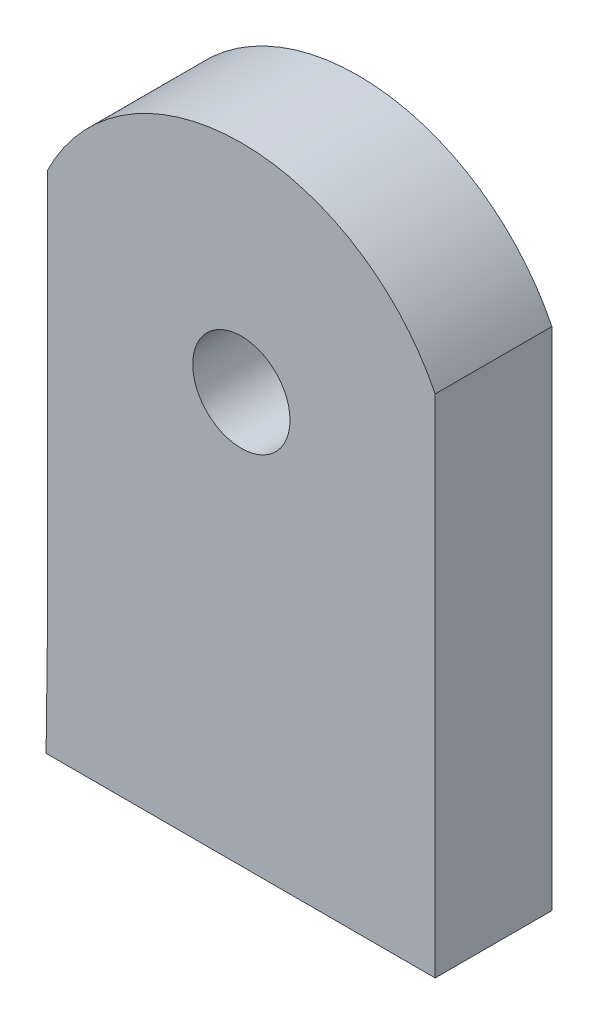
from build123d import *

# Parameters (mm, degrees)
SKETCH1_R           = 1.25
BOSS_EXTRUDE1_DEPTH = 3


with BuildPart() as part:
    # Sketch1 → Boss-Extrude1 (new body)
    with BuildSketch(Plane.XY):
        with BuildLine():
            Line((-10.453152026, 49.121338482), (-10.49069983, 46.121502107))
            Line((-10.49069983, 46.121502107), (-0.49069983, 46.121502107))
            Line((-0.49069983, 46.121502107), (-0.49069983, 49.121502107))
            Line((-0.49069983, 49.121502107), (-0.49069983, 59.121338482))
            ThreePointArc((-0.49069983, 59.121338482), (-5.471925928, 62.221036999), (-10.453152026, 59.121338482))
            Line((-10.453152026, 59.121338482), (-10.453152026, 49.121338482))
        make_face()
        with Locations((-5.471925928, 56.668764069)):
            Circle(SKETCH1_R, mode=Mode.SUBTRACT)
    extrude(amount=BOSS_EXTRUDE1_DEPTH)


solid = part.part
